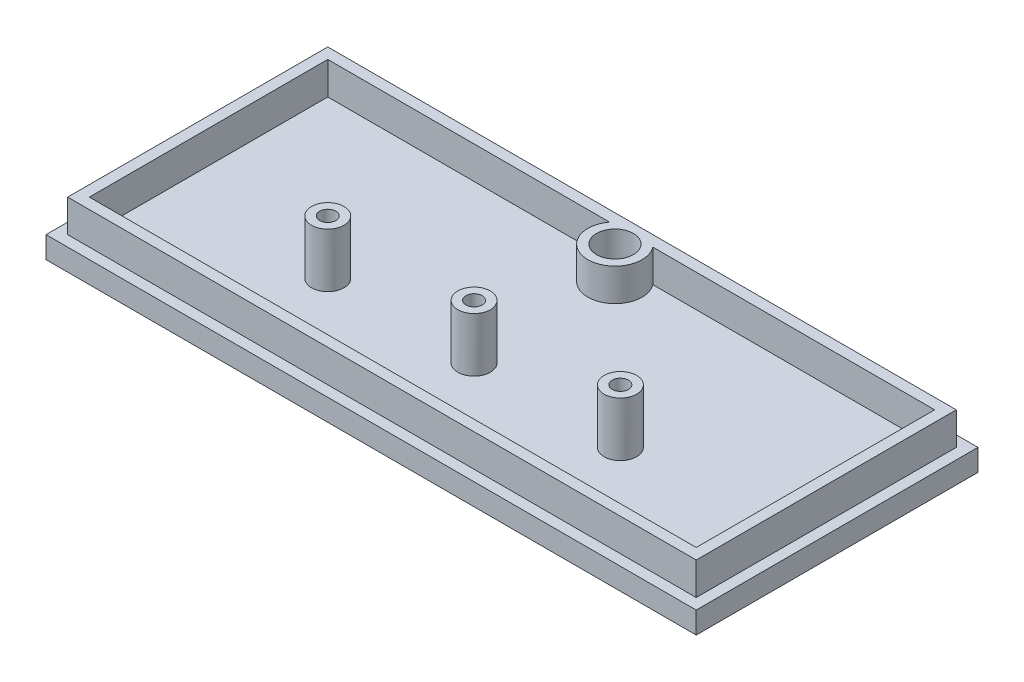
from build123d import *

# Parameters (mm, degrees)
SKETCH1_W                                       = 60
SKETCH1_H                                       = 26
BOSS_EXTRUDE1_DEPTH                             = 2
SKETCH2_W                                       = 58
SKETCH2_H                                       = 24
SKETCH2_W_2                                     = 56
SKETCH2_H_2                                     = 22
BOSS_EXTRUDE2_DEPTH                             = 3
SKETCH3_R                                       = 1.5
SKETCH3_R_2                                     = 0.75
BOSS_EXTRUDE3_DEPTH                             = 5
SKETCH6_R                                       = 2.5
BOSS_EXTRUDE4_DEPTH                             = 3
CSK_FOR_M3_FLAT_HEAD_MACHINE_SCREW1_D           = 3.4
CSK_FOR_M3_FLAT_HEAD_MACHINE_SCREW1_CSINK_D     = 6.3
CSK_FOR_M3_FLAT_HEAD_MACHINE_SCREW1_CSINK_ANGLE = 90


with BuildPart() as part:
    # Sketch1 → Boss-Extrude1 (new body)
    with BuildSketch(Plane(origin=(0, 0, 0), x_dir=(1, 0, 0), z_dir=(0, 1, 0))):
        with Locations((30, 13)):
            Rectangle(SKETCH1_W, SKETCH1_H)
    extrude(amount=BOSS_EXTRUDE1_DEPTH)

    # Sketch2 → Boss-Extrude2 (add)
    with BuildSketch(Plane(origin=(0, 2, 0), x_dir=(1, 0, 0), z_dir=(0, 1, 0))):
        with Locations((30, 13)):
            Rectangle(SKETCH2_W, SKETCH2_H)
        with Locations((30, 13)):
            Rectangle(SKETCH2_W_2, SKETCH2_H_2, mode=Mode.SUBTRACT)
    extrude(amount=BOSS_EXTRUDE2_DEPTH)

    # Sketch3 → Boss-Extrude3 (add)
    # profile 1 of 3: a face of its own
    with BuildSketch(Plane(origin=(0, 2, 0), x_dir=(1, 0, 0), z_dir=(0, 1, 0))):
        with Locations(Location((16.5, 9.5, 0), (0, 0, 90))):
            Circle(SKETCH3_R)
        with Locations(Location((16.5, 9.5, 0), (0, 0, 270))):
            Circle(SKETCH3_R_2, mode=Mode.SUBTRACT)
    # profile 2 of 3: a face of its own
    with BuildSketch(Plane(origin=(0, 2, 0), x_dir=(1, 0, 0), z_dir=(0, 1, 0))):
        with Locations(Location((30, 9.5, 0), (0, 0, 90))):
            Circle(SKETCH3_R)
        with Locations(Location((30, 9.5, 0), (0, 0, 270))):
            Circle(SKETCH3_R_2, mode=Mode.SUBTRACT)
    # profile 3 of 3: a face of its own
    with BuildSketch(Plane(origin=(0, 2, 0), x_dir=(1, 0, 0), z_dir=(0, 1, 0))):
        with Locations(Location((43.5, 9.5, 0), (0, 0, 90))):
            Circle(SKETCH3_R)
        with Locations(Location((43.5, 9.5, 0), (0, 0, 270))):
            Circle(SKETCH3_R_2, mode=Mode.SUBTRACT)
    extrude(amount=BOSS_EXTRUDE3_DEPTH)

    # Sketch6 → Boss-Extrude4 (add)
    with BuildSketch(Plane(origin=(0, 2, 0), x_dir=(1, 0, 0), z_dir=(0, 1, 0))):
        with Locations((30, 22.5)):
            Circle(SKETCH6_R)
    extrude(amount=BOSS_EXTRUDE4_DEPTH)

    # CSK for M3 Flat Head Machine Screw1 (through all)
    with Locations(Plane(origin=(0, 0, 0), x_dir=(-1, 0, 0), z_dir=(0, -1, 0))):
        with Locations((-30, 22.5)):
            CounterSinkHole(CSK_FOR_M3_FLAT_HEAD_MACHINE_SCREW1_D / 2, CSK_FOR_M3_FLAT_HEAD_MACHINE_SCREW1_CSINK_D / 2, counter_sink_angle=CSK_FOR_M3_FLAT_HEAD_MACHINE_SCREW1_CSINK_ANGLE)


solid = part.part
